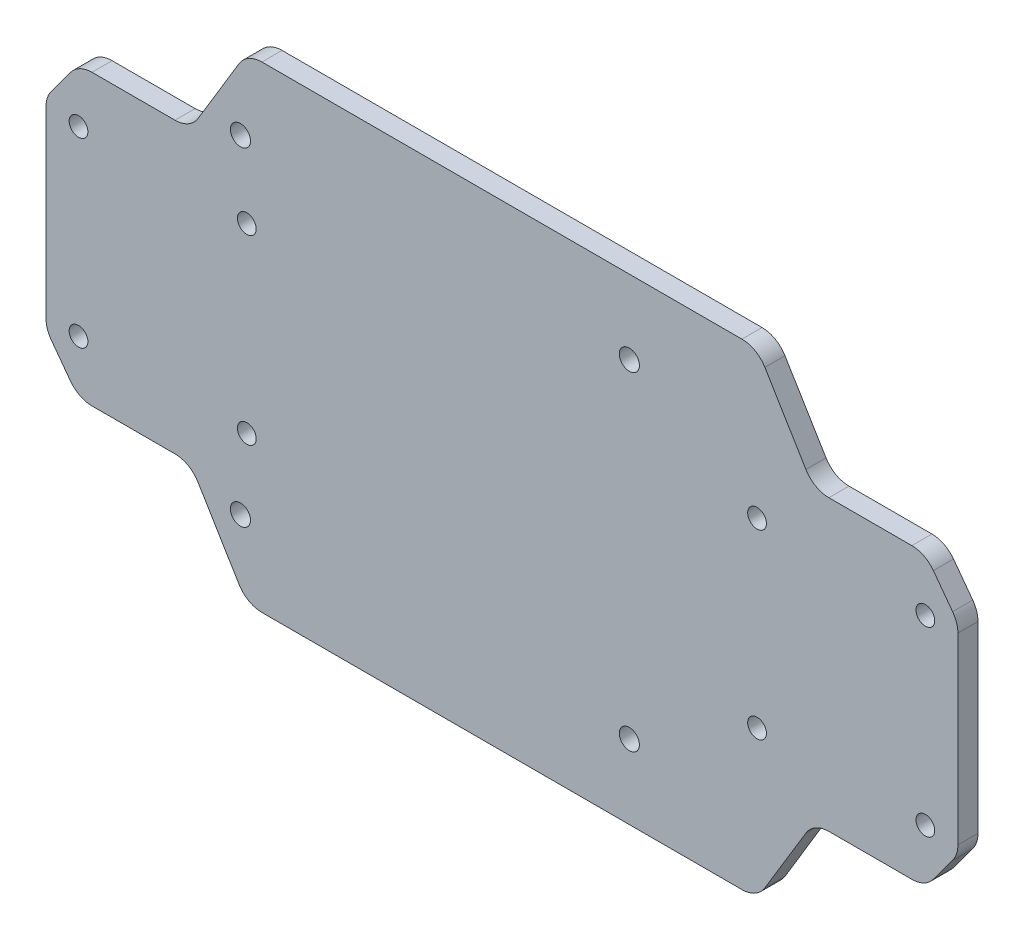
from build123d import *

# Parameters (mm, degrees)
SKETCH1_R           = 1.4
SKETCH1_R_2         = 1.5
BOSS_EXTRUDE1_DEPTH = 3


with BuildPart() as part:
    # Sketch1 → Boss-Extrude1 (new body)
    with BuildSketch(Plane.XY):
        with BuildLine():
            Line((68, -13.680285878), (68, 13.680285878))
            ThreePointArc((68, 13.680285878), (67.79859538, 14.93355087), (67.21466343, 16.060609182))
            Line((67.21466343, 16.060609182), (64.349302592, 19.930323303))
            ThreePointArc((64.349302592, 19.930323303), (62.93445954, 21.122204726), (61.134639162, 21.55))
            Line((61.134639162, 21.55), (48.7578418, 21.55))
            ThreePointArc((48.7578418, 21.55), (46.79161141, 22.066619738), (45.333277733, 23.483030974))
            Line((45.333277733, 23.483030974), (39.216722267, 33.616969026))
            ThreePointArc((39.216722267, 33.616969026), (37.75838859, 35.033380262), (35.7921582, 35.55))
            Line((35.7921582, 35.55), (-35.7921582, 35.55))
            ThreePointArc((-35.7921582, 35.55), (-37.75838859, 35.033380262), (-39.216722267, 33.616969026))
            Line((-39.216722267, 33.616969026), (-45.333277733, 23.483030974))
            ThreePointArc((-45.333277733, 23.483030974), (-46.79161141, 22.066619738), (-48.7578418, 21.55))
            Line((-48.7578418, 21.55), (-61.134639162, 21.55))
            ThreePointArc((-61.134639162, 21.55), (-62.93445954, 21.122204726), (-64.349302592, 19.930323303))
            Line((-64.349302592, 19.930323303), (-67.21466343, 16.060609182))
            ThreePointArc((-67.21466343, 16.060609182), (-67.79859538, 14.93355087), (-68, 13.680285878))
            Line((-68, 13.680285878), (-68, -13.680285878))
            ThreePointArc((-68, -13.680285878), (-67.79859538, -14.93355087), (-67.21466343, -16.060609182))
            Line((-67.21466343, -16.060609182), (-64.349302592, -19.930323303))
            ThreePointArc((-64.349302592, -19.930323303), (-62.93445954, -21.122204726), (-61.134639162, -21.55))
            Line((-61.134639162, -21.55), (-48.7578418, -21.55))
            ThreePointArc((-48.7578418, -21.55), (-46.79161141, -22.066619738), (-45.333277733, -23.483030974))
            Line((-45.333277733, -23.483030974), (-39.216722267, -33.616969026))
            ThreePointArc((-39.216722267, -33.616969026), (-37.75838859, -35.033380262), (-35.7921582, -35.55))
            Line((-35.7921582, -35.55), (35.7921582, -35.55))
            ThreePointArc((35.7921582, -35.55), (37.75838859, -35.033380262), (39.216722267, -33.616969026))
            Line((39.216722267, -33.616969026), (45.333277733, -23.483030974))
            ThreePointArc((45.333277733, -23.483030974), (46.79161141, -22.066619738), (48.7578418, -21.55))
            Line((48.7578418, -21.55), (61.134639162, -21.55))
            ThreePointArc((61.134639162, -21.55), (62.93445954, -21.122204726), (64.349302592, -19.930323303))
            Line((64.349302592, -19.930323303), (67.21466343, -16.060609182))
            ThreePointArc((67.21466343, -16.060609182), (67.79859538, -14.93355087), (68, -13.680285878))
        make_face()
        with Locations((38.05, -13.55)):
            Circle(SKETCH1_R, mode=Mode.SUBTRACT)
        with Locations((63.15, -13.55)):
            Circle(SKETCH1_R, mode=Mode.SUBTRACT)
        with Locations(Location((63.15, 13.55, 0), (0, 0, 180))):
            Circle(SKETCH1_R, mode=Mode.SUBTRACT)
        with Locations(Location((38.05, 13.55, 0), (0, 0, 180))):
            Circle(SKETCH1_R, mode=Mode.SUBTRACT)
        with Locations(Location((-38.05, -13.55, 0), (0, 0, 180))):
            Circle(SKETCH1_R, mode=Mode.SUBTRACT)
        with Locations(Location((-63.15, -13.55, 0), (0, 0, 180))):
            Circle(SKETCH1_R, mode=Mode.SUBTRACT)
        with Locations((-63.15, 13.55)):
            Circle(SKETCH1_R, mode=Mode.SUBTRACT)
        with Locations((-38.05, 13.55)):
            Circle(SKETCH1_R, mode=Mode.SUBTRACT)
        with Locations((-39, 24.5)):
            Circle(SKETCH1_R_2, mode=Mode.SUBTRACT)
        with Locations((19, 24.5)):
            Circle(SKETCH1_R_2, mode=Mode.SUBTRACT)
        with Locations(Location((19, -24.5, 0), (0, 0, 180))):
            Circle(SKETCH1_R_2, mode=Mode.SUBTRACT)
        with Locations(Location((-39, -24.5, 0), (0, 0, 180))):
            Circle(SKETCH1_R_2, mode=Mode.SUBTRACT)
    extrude(amount=BOSS_EXTRUDE1_DEPTH)


solid = part.part
